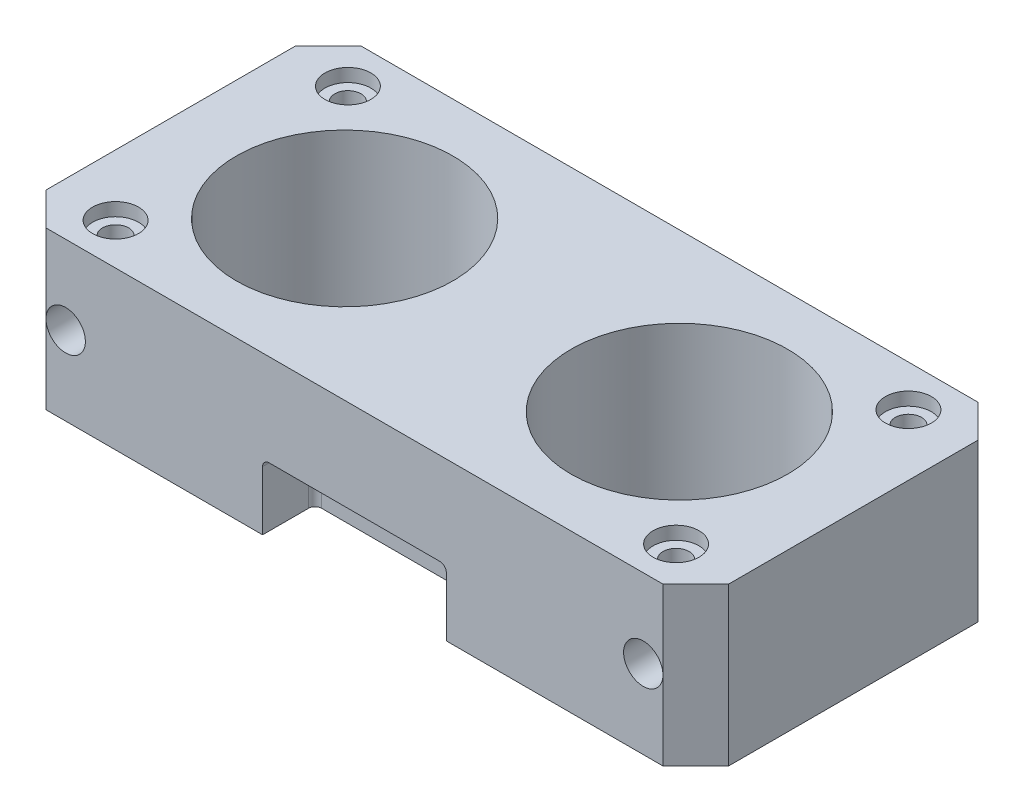
from build123d import *
from build123d.topology import SkipClean

# Parameters (mm, degrees)
SKETCH1_W                     = 52
SKETCH1_H                     = 24
SKETCH1_R                     = 8.25
BOSS_EXTRUDE1_DEPTH           = 12
SKETCH2_R                     = 1
CUT_EXTRUDE1_DEPTH            = 32.048349393
SKETCH3_R                     = 1.75
CUT_EXTRUDE2_DEPTH            = 1
CUT_EXTRUDE3_DEPTH            = 5
FILLET3_R                     = 0.5
CHAMFER1_SIZE                 = 2.5
SKETCH5_W                     = 14
SKETCH5_H                     = 8
CUT_EXTRUDE4_DEPTH            = 5
FILLET4_R                     = 0.5
CSK_FOR_M3_SFHCS2_D           = 3
CSK_FOR_M3_SFHCS2_DEPTH       = 10
CSK_FOR_M3_SFHCS2_CSINK_D     = 6.4
CSK_FOR_M3_SFHCS2_CSINK_ANGLE = 90
CSK_FOR_M3_SFHCS2_TIP         = 0.901290929
CSK_FOR_M3_SFHCS3_D           = 3
CSK_FOR_M3_SFHCS3_DEPTH       = 10
CSK_FOR_M3_SFHCS3_CSINK_D     = 6.4
CSK_FOR_M3_SFHCS3_CSINK_ANGLE = 90
CSK_FOR_M3_SFHCS3_TIP         = 0.901290929


with BuildPart() as part:
    # Sketch1 → Boss-Extrude1 (new body)
    with BuildSketch(Plane(origin=(0, 0, 0), x_dir=(1, 0, 0), z_dir=(0, 1, 0))):
        Rectangle(SKETCH1_W, SKETCH1_H)
        with Locations(Location((12.75, 0, 0), (0, 0, 270))):
            Circle(SKETCH1_R, mode=Mode.SUBTRACT)
        with Locations(Location((-12.75, 0, 0), (0, 0, 270))):
            Circle(SKETCH1_R, mode=Mode.SUBTRACT)
    extrude(amount=BOSS_EXTRUDE1_DEPTH)

    # Sketch2 → Cut-Extrude1 (cut, through all)
    with BuildSketch(Plane(origin=(0, 12, 0), x_dir=(1, 0, 0), z_dir=(0, 1, 0))):
        with Locations(Location((-21.35, 8.85, 0), (0, 0, 270))):
            Circle(SKETCH2_R)
        with Locations(Location((21.35, 8.85, 0), (0, 0, 270))):
            Circle(SKETCH2_R)
        with Locations(Location((21.35, -8.85, 0), (0, 0, 270))):
            Circle(SKETCH2_R)
        with Locations(Location((-21.35, -8.85, 0), (0, 0, 270))):
            Circle(SKETCH2_R)
    extrude(amount=-CUT_EXTRUDE1_DEPTH, mode=Mode.SUBTRACT)

    # Sketch3 → Cut-Extrude2 (cut)
    with BuildSketch(Plane(origin=(0, 12, 0), x_dir=(1, 0, 0), z_dir=(0, 1, 0))):
        with Locations(Location((-21.35, 8.85, 0), (0, 0, 270))):
            Circle(SKETCH3_R)
        with Locations(Location((21.35, 8.85, 0), (0, 0, 270))):
            Circle(SKETCH3_R)
        with Locations(Location((21.35, -8.85, 0), (0, 0, 270))):
            Circle(SKETCH3_R)
        with Locations(Location((-21.35, -8.85, 0), (0, 0, 270))):
            Circle(SKETCH3_R)
    extrude(amount=-CUT_EXTRUDE2_DEPTH, mode=Mode.SUBTRACT)

    # Sketch4 → Cut-Extrude3 (cut)
    with BuildSketch(Plane.XZ):
        Polygon((-6, -5), (-6, -12), (6, -12), (6, -5), (0, -5), align=None)
    extrude(amount=-CUT_EXTRUDE3_DEPTH, mode=Mode.SUBTRACT)

    # Fillet3
    fillet3_edges = [part.edges().sort_by_distance(p)[0] for p in [
        (-6, 2.5, -5),
        (6, 5, -8.5),
        (6, 2.5, -5),
        (-6, 5, -8.5),
        (0, 5, -5),
    ]]
    fillet(fillet3_edges, radius=FILLET3_R)

    # Chamfer1
    chamfer1_edges = [part.edges().sort_by_distance(p)[0] for p in [
        (26, 6, 12),
        (-26, 6, 12),
        (-26, 6, -12),
        (26, 6, -12),
    ]]
    chamfer(chamfer1_edges, length=CHAMFER1_SIZE)

    # Sketch5 → Cut-Extrude4 (cut)
    with BuildSketch(Plane.XZ):
        with Locations((0, 12)):
            Rectangle(SKETCH5_W, SKETCH5_H)
    extrude(amount=-CUT_EXTRUDE4_DEPTH, mode=Mode.SUBTRACT)

    # Fillet4
    fillet4_edges = [part.edges().sort_by_distance(p)[0] for p in [
        (-7, 2.5, 8),
        (7, 5, 10),
        (0, 5, 8),
        (-7, 5, 10),
        (7, 2.5, 8),
    ]]
    fillet(fillet4_edges, radius=FILLET4_R)

    # CSK for M3 SFHCS2
    with Locations(Plane(origin=(-1333.247292614, 660.683007616, 18.5), x_dir=(0, -1, 0), z_dir=(0, 0, 1))):
        with Locations((654.683007616, 1355.247292614), (654.683007616, 1311.247292614), (736.683007616, 1355.247292614), (736.683007616, 1311.247292614)):
            CounterSinkHole(CSK_FOR_M3_SFHCS2_D / 2, CSK_FOR_M3_SFHCS2_CSINK_D / 2, depth=CSK_FOR_M3_SFHCS2_DEPTH, counter_sink_angle=CSK_FOR_M3_SFHCS2_CSINK_ANGLE)
            with Locations((0, 0, -(CSK_FOR_M3_SFHCS2_DEPTH + CSK_FOR_M3_SFHCS2_TIP / 2))):  # 118° drill point
                Cone(0, CSK_FOR_M3_SFHCS2_D / 2, CSK_FOR_M3_SFHCS2_TIP, mode=Mode.SUBTRACT)

    # CSK for M3 SFHCS3
    with Locations(Plane(origin=(1333.247292614, -730.683007616, 18.5), x_dir=(0, 1, 0), z_dir=(0, 0, 1))):
        with Locations((654.683007616, 1355.247292614), (654.683007616, 1311.247292614), (736.683007616, 1355.247292614), (736.683007616, 1311.247292614)):
            CounterSinkHole(CSK_FOR_M3_SFHCS3_D / 2, CSK_FOR_M3_SFHCS3_CSINK_D / 2, depth=CSK_FOR_M3_SFHCS3_DEPTH, counter_sink_angle=CSK_FOR_M3_SFHCS3_CSINK_ANGLE)
            with Locations((0, 0, -(CSK_FOR_M3_SFHCS3_DEPTH + CSK_FOR_M3_SFHCS3_TIP / 2))):  # 118° drill point
                Cone(0, CSK_FOR_M3_SFHCS3_D / 2, CSK_FOR_M3_SFHCS3_TIP, mode=Mode.SUBTRACT)


solid = part.part
